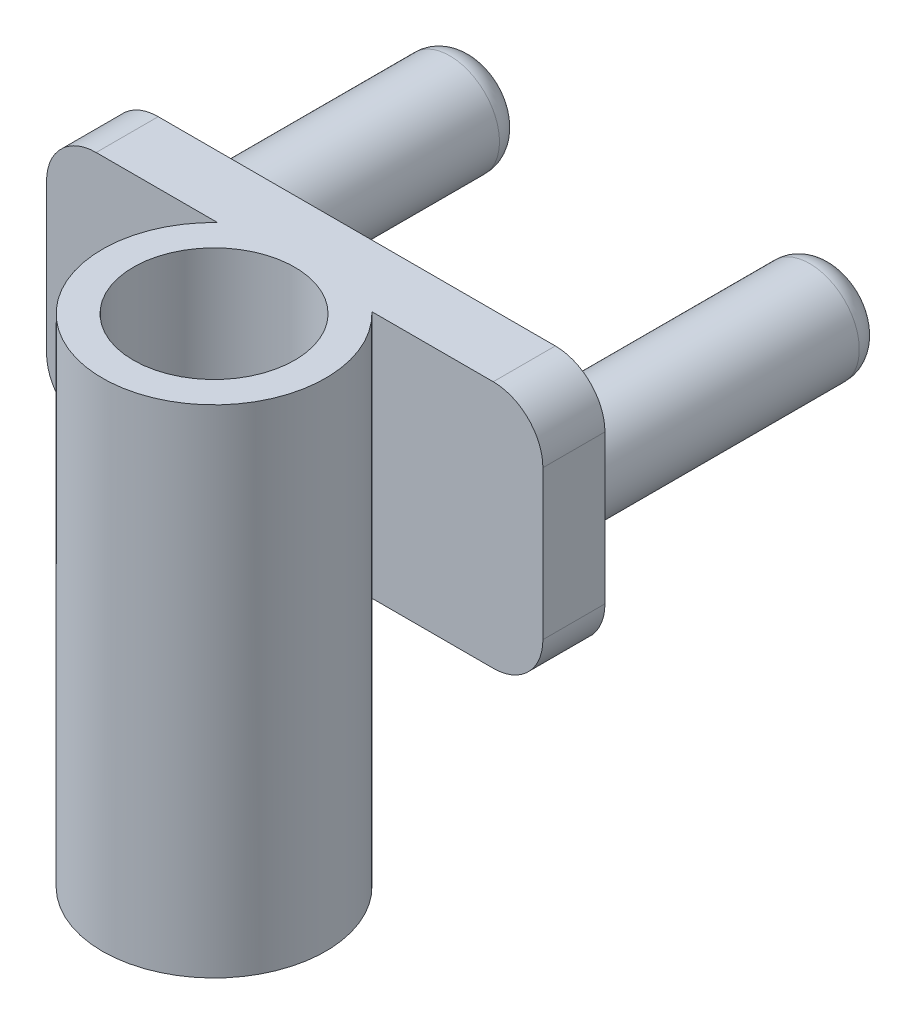
from build123d import *

# Parameters (mm, degrees)
SKETCH1_R           = 4.5
SKETCH1_R_2         = 3.25
BOSS_EXTRUDE1_DEPTH = 20
SKETCH2_W           = 20
SKETCH2_H           = 10
BOSS_EXTRUDE2_DEPTH = 1.25
FILLET1_R           = 2
SKETCH3_R           = 2
BOSS_EXTRUDE3_DEPTH = 12
LPATTERN3_COUNT     = 2
LPATTERN3_PITCH     = 14.5
FILLET2_R           = 1


with BuildPart() as part:
    # Sketch1 → Boss-Extrude1 (new body)
    with BuildSketch(Plane(origin=(0, 0, 0), x_dir=(1, 0, 0), z_dir=(0, 1, 0))):
        Circle(SKETCH1_R)
        Circle(SKETCH1_R_2, mode=Mode.SUBTRACT)
    extrude(amount=BOSS_EXTRUDE1_DEPTH)

    # Sketch2 → Boss-Extrude2 (add, symmetric)
    with BuildSketch(Plane.XY.offset(-4.5)):
        with Locations((0, 15)):
            Rectangle(SKETCH2_W, SKETCH2_H)
    extrude(amount=BOSS_EXTRUDE2_DEPTH, both=True)

    # Fillet1
    fillet1_edges = [part.edges().sort_by_distance(p)[0] for p in [
        (-10, 10, -4.5),
        (-10, 20, -4.5),
        (10, 10, -4.5),
        (10, 20, -4.5),
    ]]
    fillet(fillet1_edges, radius=FILLET1_R)

    # Sketch3 → Boss-Extrude3 (add)
    with BuildSketch(Plane(origin=(0, 0, -5.75), x_dir=(-1, 0, 0), z_dir=(0, 0, -1))):
        with Locations((-7.25, 15)):
            Circle(SKETCH3_R)
    boss_extrude3 = extrude(amount=BOSS_EXTRUDE3_DEPTH)

    # LPattern3: Boss-Extrude3 ×2
    with Locations(*[(-i * LPATTERN3_PITCH, 0, 0) for i in range(1, LPATTERN3_COUNT)]):
        add(boss_extrude3)

    # Fillet2
    fillet2_edges = [part.edges().sort_by_distance(p)[0] for p in [
        (-5.25, 15, -17.75),
        (9.25, 15, -17.75),
    ]]
    fillet(fillet2_edges, radius=FILLET2_R)


solid = part.part
